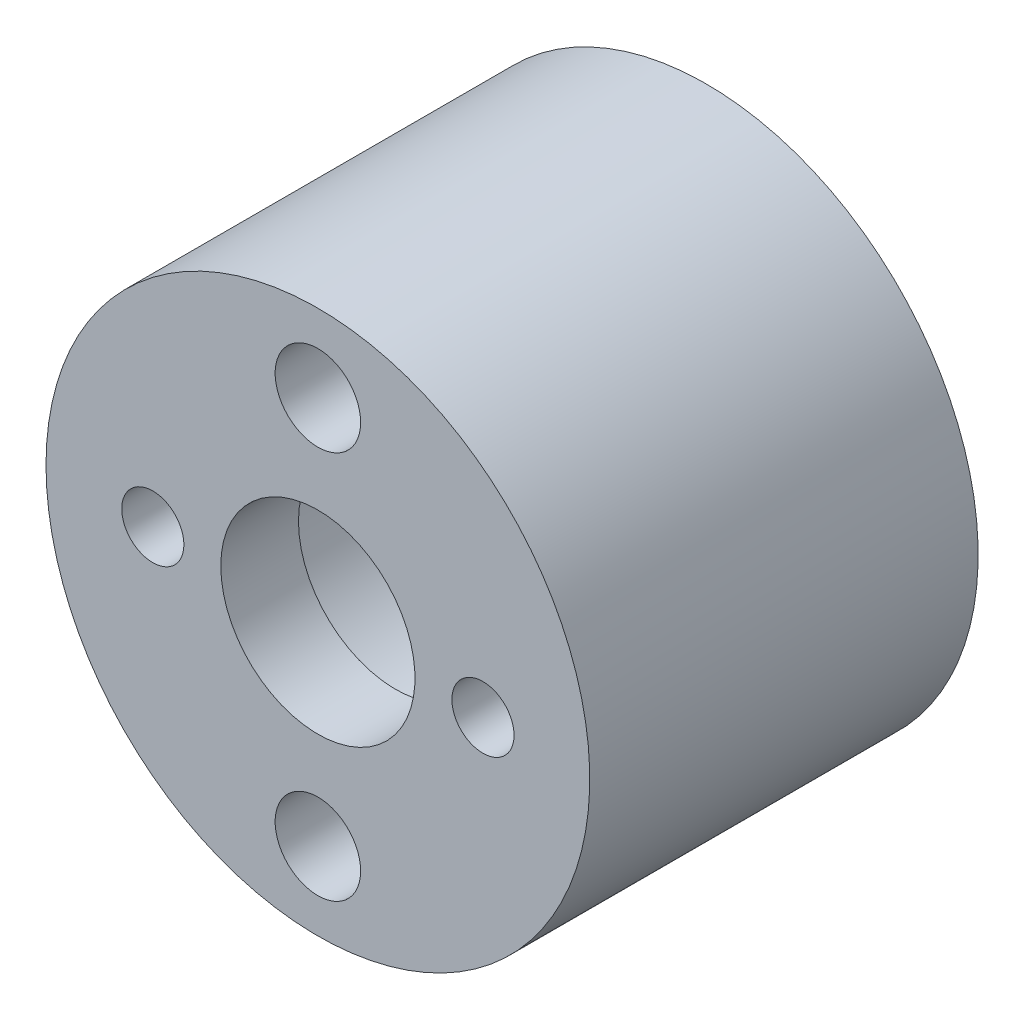
from build123d import *

# Parameters (mm, degrees)
SKETCH2_R          = 2.5
CUT_EXTRUDE1_DEPTH = 13.727922061
SKETCH3_R          = 1.1
SKETCH3_R_2        = 0.8
CUT_EXTRUDE2_DEPTH = 2
CHAMFER1_SIZE      = 0.3


with BuildPart() as part:
    # Sketch1 → Revolve1 (revolve)
    with BuildSketch(Plane(origin=(0, 0, 0), x_dir=(1, 0, 0), z_dir=(0, 1, 0)), mode=Mode.PRIVATE) as revolve1_sk:
        Polygon((0, 0), (7, 0), (7, 10), (3.5, 10), (3.5, 2), (0, 2), align=None)
    revolve(revolve1_sk.sketch.rotate(Axis((0, 0, -2), (0, 0, 1)), 180), axis=Axis((0, 0, -2), (0, 0, 1)))

    # Sketch2 → Cut-Extrude1 (cut, through all)
    with BuildSketch(Plane(origin=(0, 0, -2), x_dir=(-1, 0, 0), z_dir=(0, 0, -1))):
        Circle(SKETCH2_R)
    extrude(amount=-CUT_EXTRUDE1_DEPTH, mode=Mode.SUBTRACT)

    # Sketch3 → Cut-Extrude2 (cut)
    with BuildSketch(Plane.XY):
        with Locations((0, 5)):
            Circle(SKETCH3_R)
        with Locations((0, -5)):
            Circle(SKETCH3_R)
        with Locations((4.25, 0)):
            Circle(SKETCH3_R_2)
        with Locations((-4.25, 0)):
            Circle(SKETCH3_R_2)
    extrude(amount=-CUT_EXTRUDE2_DEPTH, mode=Mode.SUBTRACT)

    # Chamfer1
    chamfer1_edges = [part.edges().sort_by_distance(p)[0] for p in [
        (3.5, 0, -10),
    ]]
    chamfer(chamfer1_edges, length=CHAMFER1_SIZE)


solid = part.part
